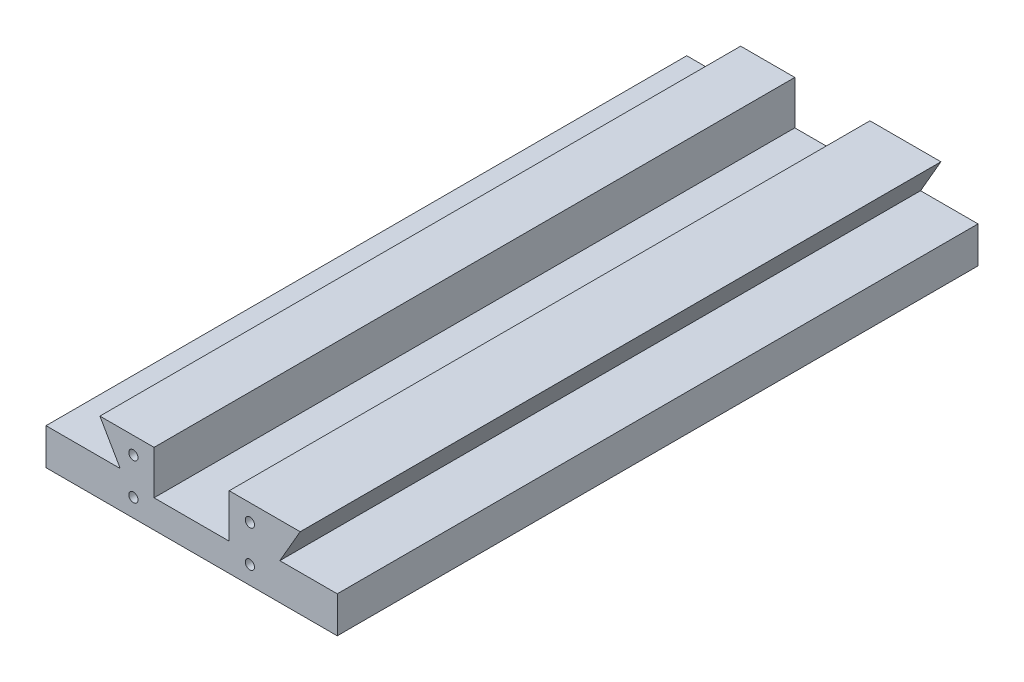
from build123d import *

# Parameters (mm, degrees)
X_GUIDE_EXTRUDE_DEPTH   = 279.4
END_PLATE_HOLES_D       = 4.0386
END_PLATE_HOLES_DEPTH   = 11.938
END_PLATE_HOLES_TIP     = 1.213317848
END_PLATE_HOLES_2_D     = 4.0386
END_PLATE_HOLES_2_DEPTH = 11.938
END_PLATE_HOLES_2_TIP   = 1.213317848


with BuildPart() as part:
    # dovetail-male-profile → x-guide-extrude (new body)
    with BuildSketch(Plane.XY):
        Polygon((47.331706063, 31.242), (16.383, 31.242), (16.383, 12.192), (-16.383, 12.192), (-16.383, 31.242), (-39.999357645, 31.242), (-31.127216058, 15.875), (-63.5, 15.875), (-63.5, 0), (63.5, 0), (63.5, 15.875), (38.459564477, 15.875), align=None)
    extrude(amount=X_GUIDE_EXTRUDE_DEPTH)

    # end plate holes
    with Locations(Plane(origin=(0, 0, 0), x_dir=(-1, 0, 0), z_dir=(0, 0, -1))):
        with Locations((-25.4, 23.8125), (25.4, 23.8125), (25.4, 7.874), (-25.4, 7.874)):
            Hole(END_PLATE_HOLES_D / 2, depth=END_PLATE_HOLES_DEPTH)
            with Locations((0, 0, -(END_PLATE_HOLES_DEPTH + END_PLATE_HOLES_TIP / 2))):  # 118° drill point
                Cone(0, END_PLATE_HOLES_D / 2, END_PLATE_HOLES_TIP, mode=Mode.SUBTRACT)

    # end plate holes 2
    with Locations(Plane.XY.offset(279.4)):
        with Locations((25.4, 23.8125), (25.4, 7.874), (-25.4, 7.874), (-25.4, 23.8125)):
            Hole(END_PLATE_HOLES_2_D / 2, depth=END_PLATE_HOLES_2_DEPTH)
            with Locations((0, 0, -(END_PLATE_HOLES_2_DEPTH + END_PLATE_HOLES_2_TIP / 2))):  # 118° drill point
                Cone(0, END_PLATE_HOLES_2_D / 2, END_PLATE_HOLES_2_TIP, mode=Mode.SUBTRACT)


solid = part.part
